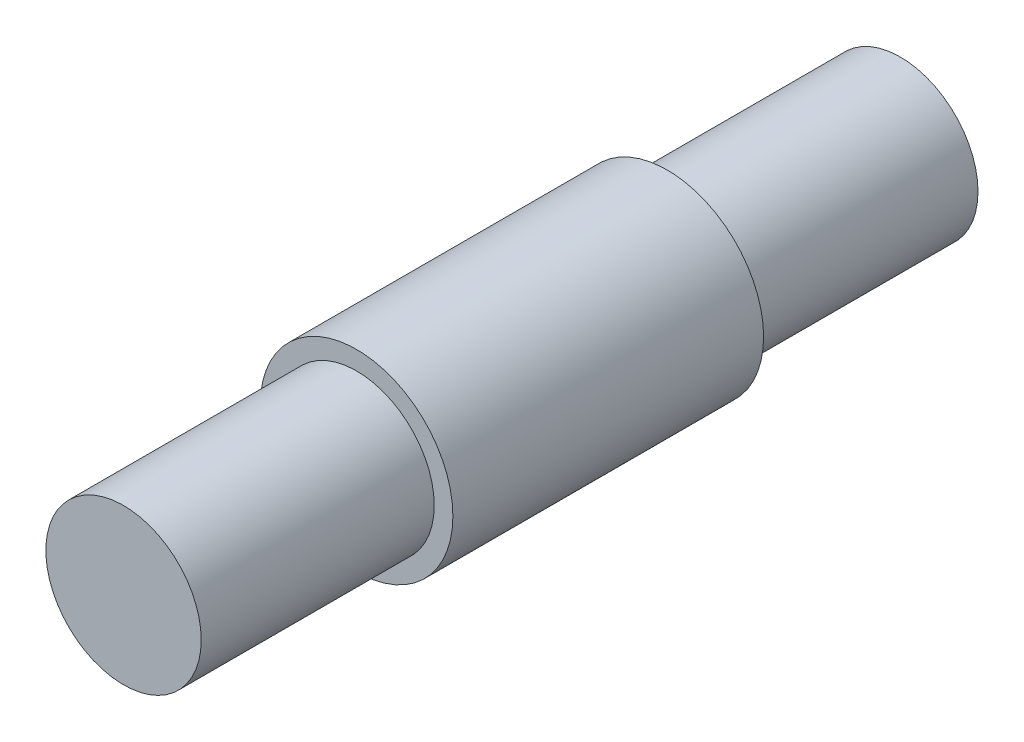
from build123d import *

# Parameters (mm, degrees)
SKETCH1_R                = 3.937
BOSS_EXTRUDE1_DEPTH      = 12.7
BOSS_EXTRUDE2_DEPTH      = 9.525
BOSS_EXTRUDE2_DEPTH_BACK = 22.225
SKETCH2_R                = 3.175


with BuildPart() as part:
    # Sketch1 → Boss-Extrude1 (new body)
    with BuildSketch(Plane.XY):
        Circle(SKETCH1_R)
    extrude(amount=BOSS_EXTRUDE1_DEPTH)

    # Sketch2 → Boss-Extrude2 (add, two sides: drawn at the far end of the back side and taken through both)
    with BuildSketch(Plane.XY.offset(12.7).offset(-BOSS_EXTRUDE2_DEPTH_BACK)):
        Circle(SKETCH2_R)
    extrude(amount=BOSS_EXTRUDE2_DEPTH + BOSS_EXTRUDE2_DEPTH_BACK)


solid = part.part
